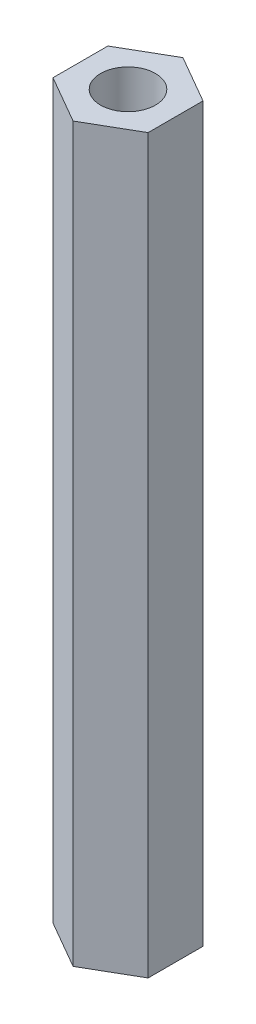
from build123d import *

# Parameters (mm, degrees)
SKETCH1_R           = 1.5
BOSS_EXTRUDE1_DEPTH = 40


with BuildPart() as part:
    # Sketch1 → Boss-Extrude1 (new body)
    with BuildSketch(Plane(origin=(0, 0, 0), x_dir=(1, 0, 0), z_dir=(0, 1, 0))):
        Polygon((0, 3), (-2.598076211, 1.5), (-2.598076211, -1.5), (0, -3), (2.598076211, -1.5), (2.598076211, 1.5), align=None)
        with Locations(Location((0, 0, 0), (0, 0, 270))):
            Circle(SKETCH1_R, mode=Mode.SUBTRACT)
    extrude(amount=BOSS_EXTRUDE1_DEPTH)


solid = part.part
